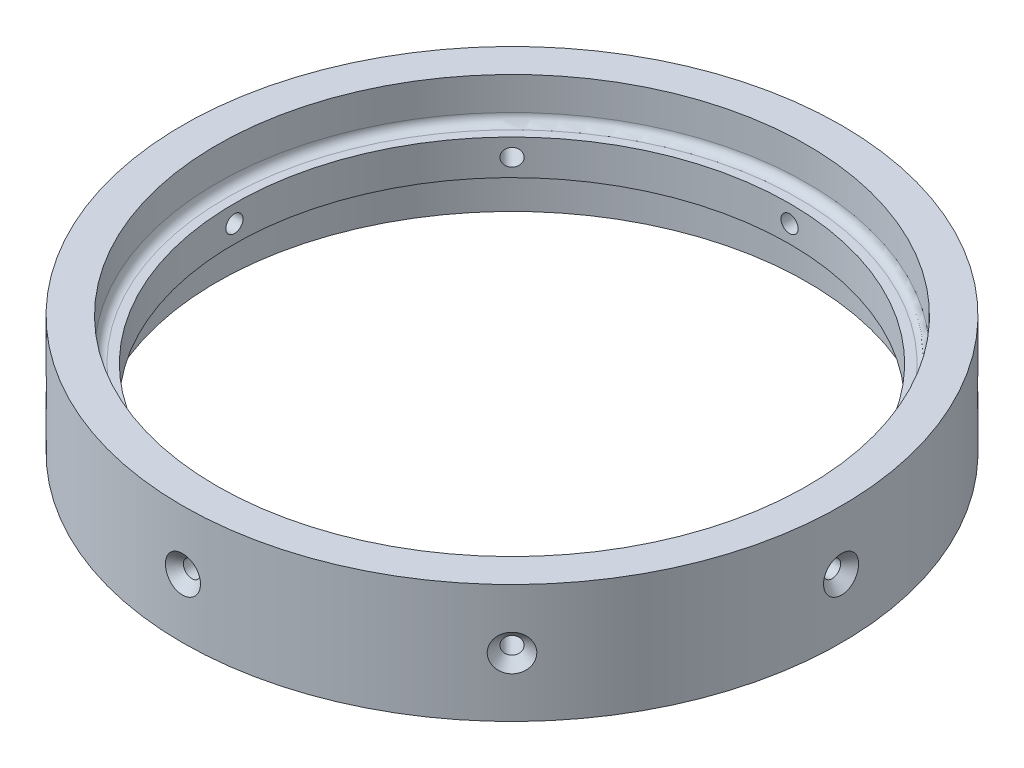
from build123d import *

# Parameters (mm, degrees)
SKETCH1_R                                         = 75
SKETCH1_R_2                                       = 67.2
BOSS_EXTRUDE1_DEPTH                               = 27
CSK_FOR_M3_5_FLAT_HEAD_MACHINE_SCREW1_D           = 3.9
CSK_FOR_M3_5_FLAT_HEAD_MACHINE_SCREW1_CSINK_D     = 8.2
CSK_FOR_M3_5_FLAT_HEAD_MACHINE_SCREW1_CSINK_ANGLE = 90
SKETCH7_R                                         = 67.2
SKETCH7_R_2                                       = 63.2
BOSS_EXTRUDE2_DEPTH                               = 4
CIRPATTERN1_COUNT                                 = 8
FILLET1_R                                         = 2


with BuildPart() as part:
    # Sketch1 → Boss-Extrude1 (new body)
    with BuildSketch(Plane(origin=(0, 0, 0), x_dir=(1, 0, 0), z_dir=(0, 1, 0))):
        Circle(SKETCH1_R)
        Circle(SKETCH1_R_2, mode=Mode.SUBTRACT)
    extrude(amount=BOSS_EXTRUDE1_DEPTH)

    # CSK for M3.5 Flat Head Machine Screw1 (through all)
    with Locations(Plane(origin=(-75, 13.5, 0), x_dir=(0, 0, -1), z_dir=(-1, 0, 0))):
        with Locations((0, 0)):
            csk_for_m3_5_flat_head_machine_screw1 = CounterSinkHole(CSK_FOR_M3_5_FLAT_HEAD_MACHINE_SCREW1_D / 2, CSK_FOR_M3_5_FLAT_HEAD_MACHINE_SCREW1_CSINK_D / 2, counter_sink_angle=CSK_FOR_M3_5_FLAT_HEAD_MACHINE_SCREW1_CSINK_ANGLE)

    # Sketch7 → Boss-Extrude2 (add, symmetric)
    with BuildSketch(Plane(origin=(0, 13.5, 0), x_dir=(1, 0, 0), z_dir=(0, 1, 0))):
        Circle(SKETCH7_R)
        Circle(SKETCH7_R_2, mode=Mode.SUBTRACT)
    extrude(amount=BOSS_EXTRUDE2_DEPTH, both=True)

    # CirPattern1: CSK for M3.5 Flat Head Machine Screw1 ×8 about axis
    cirpattern1_axis = Axis((0, 27, 0), (0, -1, 0))
    for i in range(1, CIRPATTERN1_COUNT):
        add(csk_for_m3_5_flat_head_machine_screw1.rotate(cirpattern1_axis, i * 360 / CIRPATTERN1_COUNT), mode=Mode.SUBTRACT)

    # Fillet1
    fillet1_edges = [part.edges().sort_by_distance(p)[0] for p in [
        (-67.2, 9.5, 0),
        (-67.2, 17.5, 0),
    ]]
    fillet(fillet1_edges, radius=FILLET1_R)


solid = part.part
